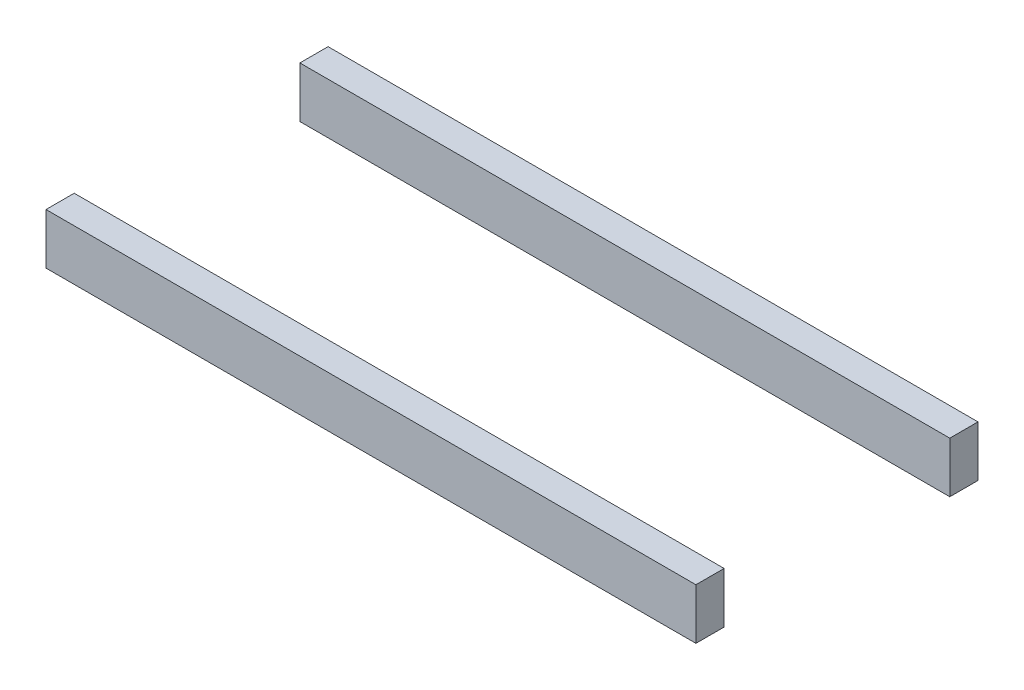
from build123d import *

# Parameters (mm, degrees)
SKETCH1_W           = 55.195911414
SKETCH1_H           = 50
BOSS_EXTRUDE1_DEPTH = 70
SKETCH2_W           = 55.195911414
SKETCH2_H           = 15
BOSS_EXTRUDE2_DEPTH = 10
BOSS_EXTRUDE3_DEPTH = 60
SKETCH4_W           = 20
SKETCH4_H           = 9.75
BOSS_EXTRUDE4_DEPTH = 25
SKETCH5_W           = 10
SKETCH5_H           = 20
BOSS_EXTRUDE5_DEPTH = 10
SKETCH6_W           = 70
SKETCH6_H           = 1
CUT_EXTRUDE1_DEPTH  = 161.561183283
SKETCH7_W           = 10
SKETCH7_H           = 59
CUT_EXTRUDE2_DEPTH  = 161.346167953
SKETCH8_W           = 146.025432046
SKETCH8_H           = 53.713621204
CUT_EXTRUDE3_DEPTH  = 50


with BuildPart() as part:
    # Sketch1 → Boss-Extrude1 (new body)
    with BuildSketch(Plane.XY):
        Rectangle(SKETCH1_W, SKETCH1_H)
    extrude(amount=-BOSS_EXTRUDE1_DEPTH)

    # Sketch2 → Boss-Extrude2 (add)
    with BuildSketch(Plane(origin=(0, 25, 0), x_dir=(1, 0, 0), z_dir=(0, 1, 0))):
        with Locations((0, 7.5)):
            Rectangle(SKETCH2_W, SKETCH2_H)
        with Locations((0, 62.5)):
            Rectangle(SKETCH2_W, SKETCH2_H)
    extrude(amount=BOSS_EXTRUDE2_DEPTH)

    # Sketch3 → Boss-Extrude3 (add)
    with BuildSketch(Plane.ZY.offset(27.597955707)):
        Polygon((0, -25), (0, 35), (-15, 35), (-15, 25), (-55, 25), (-55, 35), (-70, 35), (-70, -25), align=None)
    extrude(amount=BOSS_EXTRUDE3_DEPTH)

    # Sketch4 → Boss-Extrude4 (add)
    with BuildSketch(Plane.ZY.offset(87.597955707)):
        with Locations((-35, -20.125)):
            Rectangle(SKETCH4_W, SKETCH4_H)
    extrude(amount=BOSS_EXTRUDE4_DEPTH)

    # Sketch5 → Boss-Extrude5 (add)
    with BuildSketch(Plane(origin=(0, -15.25, 0), x_dir=(1, 0, 0), z_dir=(0, 1, 0))):
        with Locations((-107.597955707, 35)):
            Rectangle(SKETCH5_W, SKETCH5_H)
    extrude(amount=BOSS_EXTRUDE5_DEPTH)

    # Sketch6 → Cut-Extrude1 (cut, through all)
    with BuildSketch(Plane(origin=(27.597955707, 0, 0), x_dir=(0, 0, -1), z_dir=(1, 0, 0))):
        with Locations((35, 34.5)):
            Rectangle(SKETCH6_W, SKETCH6_H)
    extrude(amount=-CUT_EXTRUDE1_DEPTH, mode=Mode.SUBTRACT)

    # Sketch7 → Cut-Extrude2 (cut, through all)
    with BuildSketch(Plane(origin=(27.597955707, 0, 0), x_dir=(0, 0, -1), z_dir=(1, 0, 0))):
        with Locations((5, 4.5)):
            Rectangle(SKETCH7_W, SKETCH7_H)
        with Locations((65, 4.5)):
            Rectangle(SKETCH7_W, SKETCH7_H)
    extrude(amount=-CUT_EXTRUDE2_DEPTH, mode=Mode.SUBTRACT)

    # Sketch8 → Cut-Extrude3 (cut)
    with BuildSketch(Plane.XZ.offset(25)):
        with Locations((-45.414760316, -33.143189398)):
            Rectangle(SKETCH8_W, SKETCH8_H)
    extrude(amount=-CUT_EXTRUDE3_DEPTH, mode=Mode.SUBTRACT)


with BuildPart() as cut_extrude3_piece_1:
    # of the separate pieces the step leaves, piece 1, a body of its own (cut_extrude3_pieces)
    add(part.part.solids().sort_by_distance((27.597955707, 25, -55))[0])


with BuildPart() as cut_extrude3_piece_2:
    # of the separate pieces the step leaves, piece 2, a body of its own (cut_extrude3_pieces)
    add(part.part.solids().sort_by_distance((27.597955707, 25, -15))[0])


solid = Compound([cut_extrude3_piece_1.part, cut_extrude3_piece_2.part])
